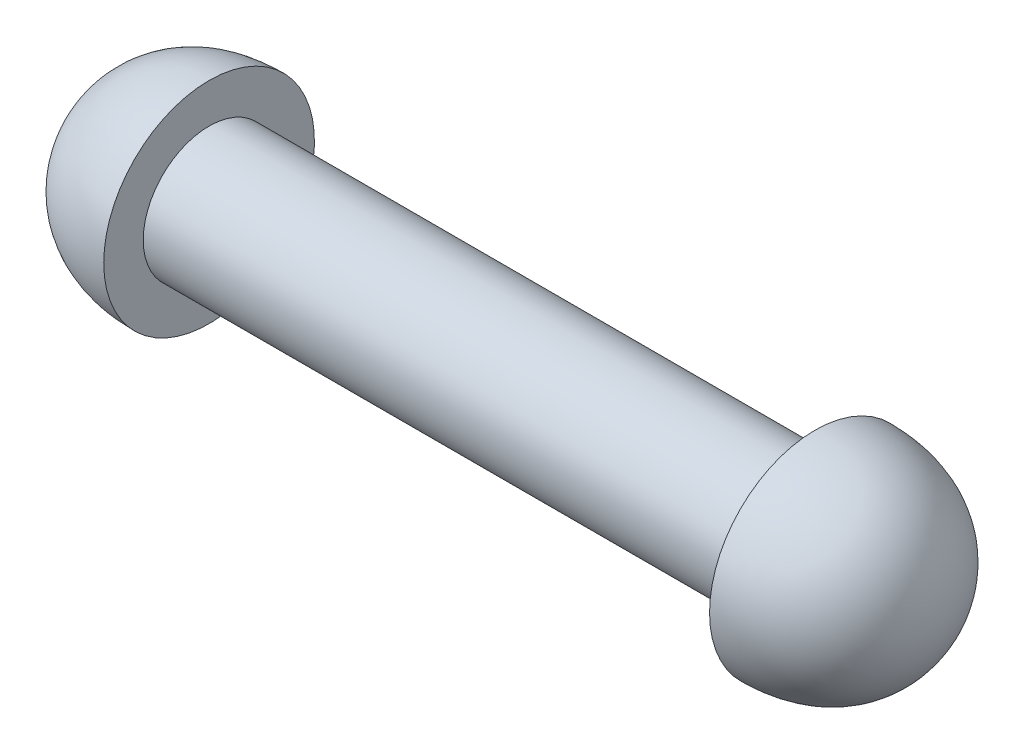
from build123d import *

# Parameters (mm, degrees)
SKETCH1_R           = 25
BOSS_EXTRUDE1_DEPTH = 115


with BuildPart() as part:
    # Sketch1 → Boss-Extrude1 (new body)
    with BuildSketch(Plane(origin=(0, 0, 0), x_dir=(0, 0, -1), z_dir=(1, 0, 0))):
        Circle(SKETCH1_R)
    boss_extrude1 = extrude(amount=BOSS_EXTRUDE1_DEPTH)

    # Sketch3 → Revolve1 (revolve)
    with BuildSketch(Plane.XY, mode=Mode.PRIVATE) as revolve1_sk:
        with BuildLine():
            Line((0, 0), (-45.458392513, 0))
            add(Edge.make_bspline(
                [(-45.458392513, 0), (-45.458392513, 20.183781855), (-30.991238831, 40), (0, 40)],
                knots=[0, 0, 0, 0, 1, 1, 1, 1], degree=3))
            Line((0, 40), (0, 0))
        make_face()
    revolve1 = revolve(revolve1_sk.sketch.rotate(Axis((-100.078673334, 0, 0), (1, 0, 0)), 90), axis=Axis((-100.078673334, 0, 0), (1, 0, 0)))

    # Mirror1: Boss-Extrude1, Revolve1 across plane
    add(boss_extrude1.mirror(Plane(origin=(115, 0, 0), x_dir=(0, 0, 1), z_dir=(1, 0, 0))))
    add(revolve1.mirror(Plane(origin=(115, 0, 0), x_dir=(0, 0, 1), z_dir=(1, 0, 0))))


solid = part.part
